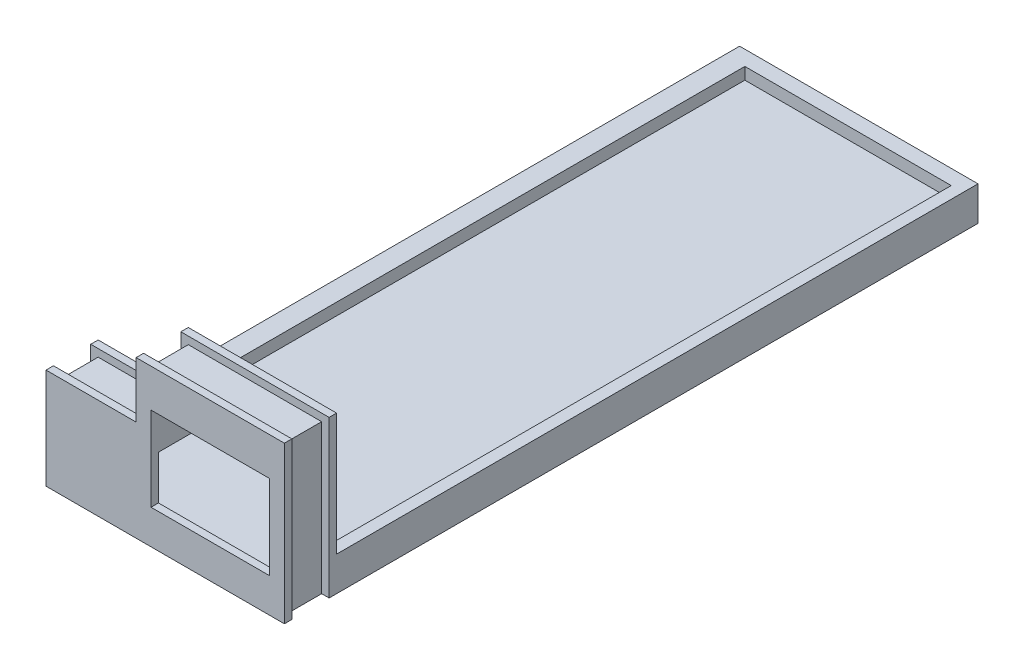
from build123d import *

# Parameters (mm, degrees)
SKETCH_2_W          = 15.902311404
SKETCH_2_H          = 11.3
EXTRUDE_1_DEPTH     = 5
EXTRUDE_2_DEPTH     = 1
EXTRUDE_4_DEPTH     = 1
SKETCH_6_W          = 15.902311404
SKETCH_6_H          = 11.3
CUT_EXTRUDE_1_DEPTH = 36.003849734
SKETCH_7_W          = 27.70005588
SKETCH_7_H          = 1.6
CUT_EXTRUDE_2_DEPTH = 6
EXTRUDE_5_DEPTH     = 84.1
SKETCH_9_W          = 32
SKETCH_9_H          = 4.6
EXTRUDE_6_DEPTH     = 2
SKETCH_10_W         = 11.391343663
SKETCH_10_H         = 5.9
CUT_EXTRUDE_3_DEPTH = 6


with BuildPart() as part:
    # 草图2 → 凸台-拉伸1 (new body)
    with BuildSketch(Plane.XY):
        Polygon((-1.806344933, -3), (28.193655067, -3), (28.193655067, 17), (10.291343663, 17), (10.291343663, 9.5), (-1.806344933, 9.5), align=None)
        with Locations((19.242499365, 7.25)):
            Rectangle(SKETCH_2_W, SKETCH_2_H, mode=Mode.SUBTRACT)
    extrude(amount=EXTRUDE_1_DEPTH)

    # 草图3 → 凸台-拉伸2 (add)
    with BuildSketch(Plane.XY.offset(5)):
        Polygon((-2.806344933, -3), (29.193655067, -3), (29.193655067, 18), (9.291343663, 18), (9.291343663, 10.5), (-2.806344933, 10.5), align=None)
    extrude(amount=EXTRUDE_2_DEPTH)

    # 草图5 → 凸台-拉伸4 (add)
    with BuildSketch(Plane(origin=(0, 0, 0), x_dir=(-1, 0, 0), z_dir=(0, 0, -1))):
        Polygon((-29.193655067, 18), (-29.193655067, -3), (-28.193655067, -3), (1.806344933, -3), (2.806344933, -3), (2.806344933, 10.5), (-9.291343663, 10.5), (-9.291343663, 18), align=None)
    extrude(amount=EXTRUDE_4_DEPTH)

    # 草图6 → 切除-拉伸1 (cut, through all)
    with BuildSketch(Plane.XY.offset(6)):
        with Locations((19.242499365, 7.25)):
            Rectangle(SKETCH_6_W, SKETCH_6_H)
    extrude(amount=-CUT_EXTRUDE_1_DEPTH, mode=Mode.SUBTRACT)

    # 草图7 → 切除-拉伸2 (cut)
    with BuildSketch(Plane(origin=(0, 0, -1), x_dir=(-1, 0, 0), z_dir=(0, 0, -1))):
        with Locations((-13.75002794, 0.8)):
            Rectangle(SKETCH_7_W, SKETCH_7_H)
    extrude(amount=-CUT_EXTRUDE_2_DEPTH, mode=Mode.SUBTRACT)

    # 草图8 → 凸台-拉伸5 (add)
    with BuildSketch(Plane(origin=(0, 0, -1), x_dir=(-1, 0, 0), z_dir=(0, 0, -1))):
        Polygon((-27.60005588, 1.6), (-29.193655067, 1.6), (-29.193655067, -3), (2.806344933, -3), (2.806344933, 1.6), (0.1, 1.6), (0.1, 0), (-27.60005588, 0), align=None)
    extrude(amount=EXTRUDE_5_DEPTH)

    # 草图9 → 凸台-拉伸6 (add)
    with BuildSketch(Plane(origin=(0, 0, -85.1), x_dir=(-1, 0, 0), z_dir=(0, 0, -1))):
        with Locations((-13.193655067, -0.7)):
            Rectangle(SKETCH_9_W, SKETCH_9_H)
    extrude(amount=EXTRUDE_6_DEPTH)

    # 草图10 → 切除-拉伸3 (cut)
    with BuildSketch(Plane(origin=(0, 0, -1), x_dir=(-1, 0, 0), z_dir=(0, 0, -1))):
        with Locations((-5.595671832, 4.55)):
            Rectangle(SKETCH_10_W, SKETCH_10_H)
    extrude(amount=-CUT_EXTRUDE_3_DEPTH, mode=Mode.SUBTRACT)


solid = part.part
